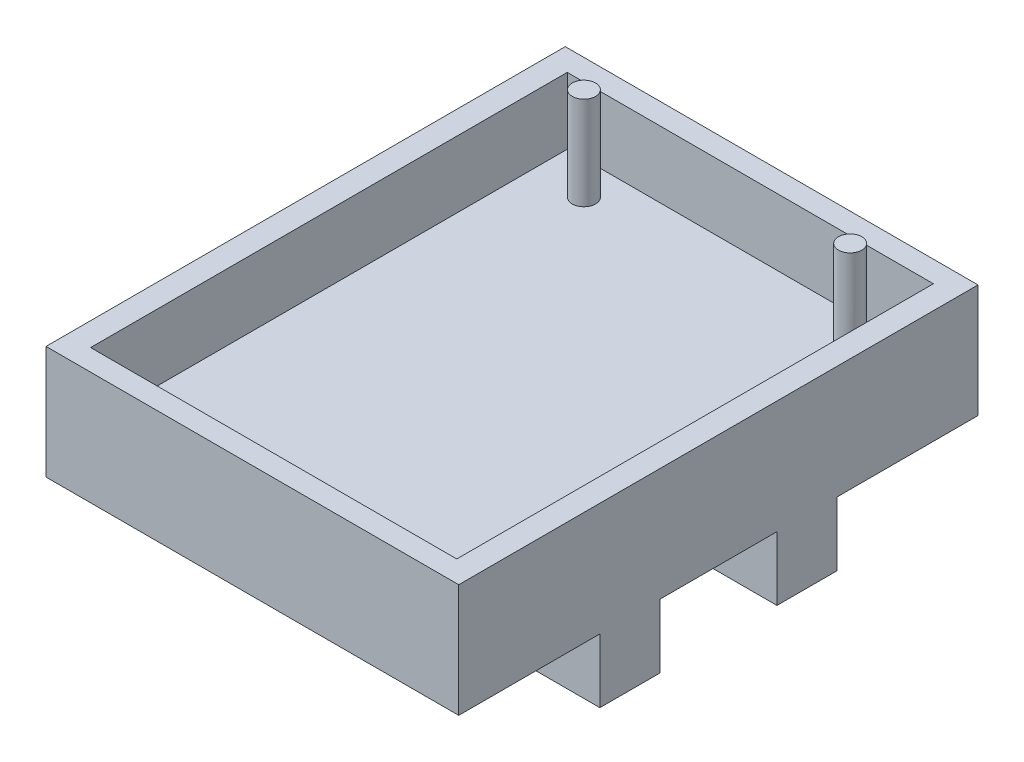
from build123d import *

# Parameters (mm, degrees)
SKETCH1_W           = 31
SKETCH1_H           = 39
BOSS_EXTRUDE1_DEPTH = 8.5
SKETCH5_W           = 31
SKETCH5_H           = 4.5
BOSS_EXTRUDE3_DEPTH = 4.8
SKETCH7_W           = 27.5
SKETCH7_H           = 35.8
CUT_EXTRUDE1_DEPTH  = 5
SKETCH8_R           = 0.875
BOSS_EXTRUDE4_DEPTH = 7


with BuildPart() as part:
    # Sketch1 → Boss-Extrude1 (new body)
    with BuildSketch(Plane(origin=(0, 0, 0), x_dir=(1, 0, 0), z_dir=(0, 1, 0))):
        Rectangle(SKETCH1_W, SKETCH1_H)
    extrude(amount=BOSS_EXTRUDE1_DEPTH)

    # Sketch5 → Boss-Extrude3 (add)
    with BuildSketch(Plane.XZ):
        with Locations((0, 6.65)):
            Rectangle(SKETCH5_W, SKETCH5_H)
    boss_extrude3 = extrude(amount=BOSS_EXTRUDE3_DEPTH)

    # Mirror1: Boss-Extrude3 across plane
    add(boss_extrude3.mirror(Plane.XY))

    # Sketch7 → Cut-Extrude1 (cut)
    with BuildSketch(Plane(origin=(0, 8.5, 0), x_dir=(1, 0, 0), z_dir=(0, 1, 0))):
        Rectangle(SKETCH7_W, SKETCH7_H)
    extrude(amount=-CUT_EXTRUDE1_DEPTH, mode=Mode.SUBTRACT)

    # Sketch8 → Boss-Extrude4 (add)
    with BuildSketch(Plane(origin=(0, 3.5, 0), x_dir=(1, 0, 0), z_dir=(0, 1, 0))):
        with Locations(Location((-10, 15.4, 0), (0, 0, 90))):
            Circle(SKETCH8_R)
        with Locations(Location((10, 15.4, 0), (0, 0, 90))):
            Circle(SKETCH8_R)
    extrude(amount=BOSS_EXTRUDE4_DEPTH)


solid = part.part
